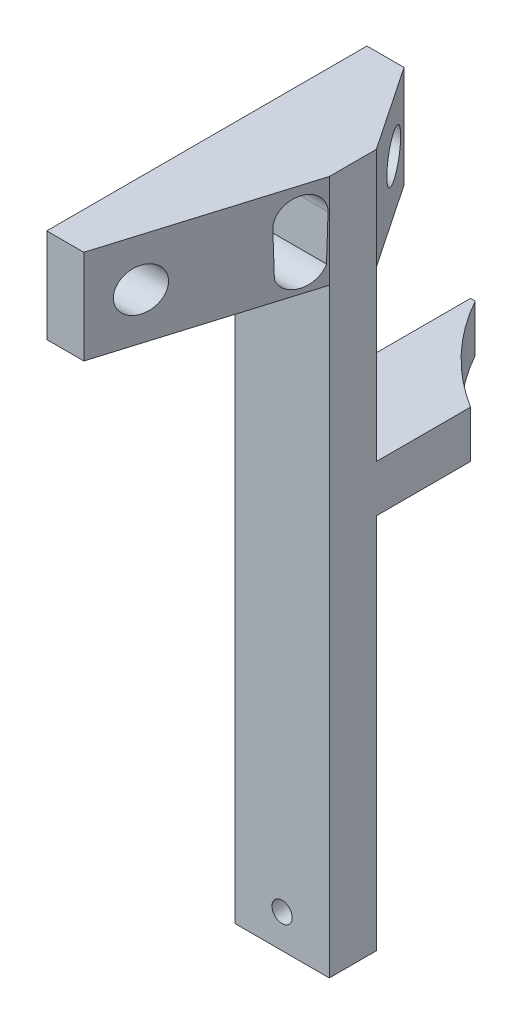
from build123d import *

# Parameters (mm, degrees)
SKETCH_1_W               = 20
SKETCH_1_H               = 147.415
SKETCH_1_R               = 2.15
EXTRUDE_1_DEPTH          = 10
SKETCH_2_W               = 20
SKETCH_2_H               = 20
EXTRUDE_2_DEPTH          = 40
SKETCH_3_W               = 20
SKETCH_3_H               = 21.635845778
EXTRUDE_3_DEPTH          = 18
CUT_EXTRUDE_1_DEPTH      = 10
CUT_EXTRUDE_1_DEPTH_BACK = 20
SKETCH_5_R               = 2.15
CUT_EXTRUDE_2_DEPTH      = 2
CUT_EXTRUDE_START        = -2
SKETCH_6_R               = 4.5
CUT_EXTRUDE_3_DEPTH      = 20
SKETCH_7_W               = 20
SKETCH_7_H               = 10
EXTRUDE_4_DEPTH          = 40
CUT_EXTRUDE_5_REACH      = 109.242


with BuildPart() as part:
    # 草图1 → 凸台-拉伸1 (new body)
    with BuildSketch(Plane.XY):
        with Locations((20.013762606, -58.095888527)):
            Rectangle(SKETCH_1_W, SKETCH_1_H)
        with Locations((20, -124.653388527)):
            Circle(SKETCH_1_R, mode=Mode.SUBTRACT)
    extrude(amount=EXTRUDE_1_DEPTH)

    # 草图2 → 凸台-拉伸2 (add)
    with BuildSketch(Plane.XY.offset(10)):
        with Locations((20.013762606, 5.611611473)):
            Rectangle(SKETCH_2_W, SKETCH_2_H)
    extrude(amount=EXTRUDE_2_DEPTH)

    # 草图3 → 凸台-拉伸3 (add)
    with BuildSketch(Plane(origin=(0, 0, 0), x_dir=(-1, 0, 0), z_dir=(0, 0, -1))):
        with Locations((-20.013762606, 4.793688584)):
            Rectangle(SKETCH_3_W, SKETCH_3_H)
    extrude(amount=EXTRUDE_3_DEPTH)

    # 草图4 → 切除-拉伸1 (cut, two sides: drawn at the far end of the back side and taken through both)
    with BuildSketch(Plane.XZ.offset(4.388388527).offset(-CUT_EXTRUDE_1_DEPTH_BACK)):
        Polygon((17.893762606, 50), (30.013762606, 50), (30.013762606, 10), align=None)
        Polygon((17.893762606, -18), (30.013762606, -18), (30.013762606, 0), align=None)
    extrude(amount=CUT_EXTRUDE_1_DEPTH + CUT_EXTRUDE_1_DEPTH_BACK, mode=Mode.SUBTRACT)

    # 草图5 → 切除-拉伸2 (cut)
    with BuildSketch(Plane.ZY.offset(-10.013762606)):
        with Locations(Location((14.7, 9.187302616, 0), (0, 0, 270))):
            Circle(SKETCH_5_R)
        with Locations(Location((14.7, 1.187302616, 0), (0, 0, 270))):
            Circle(SKETCH_5_R)
        with Locations(Location((40.7, 5.49974849, 0), (0, 0, 270))):
            Circle(SKETCH_5_R)
        with Locations(Location((-11.3, 4.874278045, 0), (0, 0, 270))):
            Circle(SKETCH_5_R)
    extrude(amount=-CUT_EXTRUDE_2_DEPTH, mode=Mode.SUBTRACT)

    # 草图6 → 切除-拉伸3 (cut)
    with BuildSketch(Plane.ZY.offset(-10.013762606).offset(CUT_EXTRUDE_START)):
        with Locations(Location((40.7, 5.49974849, 0), (0, 0, 270))):
            Circle(SKETCH_6_R)
        with Locations(Location((-11.3, 4.874278045, 0), (0, 0, 270))):
            Circle(SKETCH_6_R)
        with BuildLine():
            Line((19.2, 9.187302616), (18.942279399, -0.313718869))
            ThreePointArc((18.942279399, -0.313718869), (14.7, -3.312697384), (10.457720601, -0.313718869))
            Line((10.457720601, -0.313718869), (10.2, 9.187302616))
            ThreePointArc((10.2, 9.187302616), (14.7, 13.687302616), (19.2, 9.187302616))
        make_face()
    extrude(amount=-CUT_EXTRUDE_3_DEPTH, mode=Mode.SUBTRACT)

    # 草图7 → 凸台-拉伸4 (add)
    with BuildSketch(Plane(origin=(0, 0, 0), x_dir=(-1, 0, 0), z_dir=(0, 0, -1))):
        with Locations((-20.013762606, -46.803388527)):
            Rectangle(SKETCH_7_W, SKETCH_7_H)
    extrude(amount=EXTRUDE_4_DEPTH)

    # 草图8 → 切除-拉伸5 (cut, up to next)
    with BuildSketch(Plane(origin=(0, -41.803388527, 0), x_dir=(1, 0, 0), z_dir=(0, 1, 0)), mode=Mode.PRIVATE) as cut_extrude_5_sk1:
        with BuildLine():
            Line((30.013762606, 20), (30.013762606, 40))
            Line((30.013762606, 40), (11.013762606, 40))
            ThreePointArc((11.013762606, 40), (19.239482102, 28.789433521), (30.013762606, 20))
        make_face()
    cut_extrude_5_tool1 = extrude(cut_extrude_5_sk1.sketch, amount=-CUT_EXTRUDE_5_REACH, mode=Mode.PRIVATE) & part.part
    add(cut_extrude_5_tool1.solids().sort_by_distance((23.14433, -41.803389, -32.776655))[0], mode=Mode.SUBTRACT)


solid = part.part
